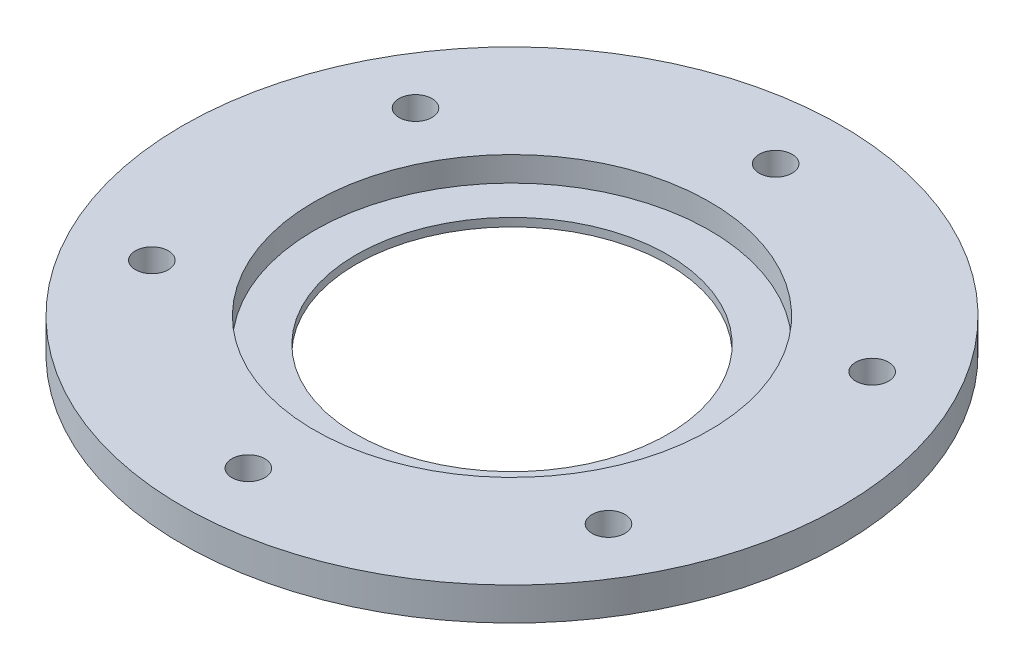
from build123d import *

# Parameters (mm, degrees)
CUT_EXTRUDE_1_REACH = 285.549
SKETCH_5_R          = 10


with BuildPart() as part:
    # 草圖4 → 旋轉1 (revolve)
    with BuildSketch(Plane.XY, mode=Mode.PRIVATE) as revolve_1_sk:
        Polygon((120, 20), (120, 5), (94.5, 5), (94.5, 0), (200, 0), (200, 20), align=None)
    revolve(revolve_1_sk.sketch.rotate(Axis((0, 45.980375907, 0), (0, -1, 0)), 180), axis=Axis((0, 45.980375907, 0), (0, -1, 0)))

    # 草圖5 → 除料-伸長1 (cut, up to next)
    with BuildSketch(Plane(origin=(0, 20, 0), x_dir=(1, 0, 0), z_dir=(0, 1, 0)), mode=Mode.PRIVATE) as cut_extrude_1_sk1:
        with Locations(Location((0, 160, 0), (0, 0, 180))):
            Circle(SKETCH_5_R)
    cut_extrude_1_tool1 = extrude(cut_extrude_1_sk1.sketch, amount=-CUT_EXTRUDE_1_REACH, mode=Mode.PRIVATE) & part.part
    # 草圖5 → 除料-伸長1 (cut, up to next)
    with BuildSketch(Plane(origin=(0, 20, 0), x_dir=(1, 0, 0), z_dir=(0, 1, 0)), mode=Mode.PRIVATE) as cut_extrude_1_sk2:
        with Locations(Location((138.564064606, 80, 0), (0, 0, 180))):
            Circle(SKETCH_5_R)
    cut_extrude_1_tool2 = extrude(cut_extrude_1_sk2.sketch, amount=-CUT_EXTRUDE_1_REACH, mode=Mode.PRIVATE) & part.part
    # 草圖5 → 除料-伸長1 (cut, up to next)
    with BuildSketch(Plane(origin=(0, 20, 0), x_dir=(1, 0, 0), z_dir=(0, 1, 0)), mode=Mode.PRIVATE) as cut_extrude_1_sk3:
        with Locations(Location((138.564064606, -80, 0), (0, 0, 180))):
            Circle(SKETCH_5_R)
    cut_extrude_1_tool3 = extrude(cut_extrude_1_sk3.sketch, amount=-CUT_EXTRUDE_1_REACH, mode=Mode.PRIVATE) & part.part
    # 草圖5 → 除料-伸長1 (cut, up to next)
    with BuildSketch(Plane(origin=(0, 20, 0), x_dir=(1, 0, 0), z_dir=(0, 1, 0)), mode=Mode.PRIVATE) as cut_extrude_1_sk4:
        with Locations(Location((0, -160, 0), (0, 0, 180))):
            Circle(SKETCH_5_R)
    cut_extrude_1_tool4 = extrude(cut_extrude_1_sk4.sketch, amount=-CUT_EXTRUDE_1_REACH, mode=Mode.PRIVATE) & part.part
    # 草圖5 → 除料-伸長1 (cut, up to next)
    with BuildSketch(Plane(origin=(0, 20, 0), x_dir=(1, 0, 0), z_dir=(0, 1, 0)), mode=Mode.PRIVATE) as cut_extrude_1_sk5:
        with Locations(Location((-138.564064605, -80, 0), (0, 0, 180))):
            Circle(SKETCH_5_R)
    cut_extrude_1_tool5 = extrude(cut_extrude_1_sk5.sketch, amount=-CUT_EXTRUDE_1_REACH, mode=Mode.PRIVATE) & part.part
    # 草圖5 → 除料-伸長1 (cut, up to next)
    with BuildSketch(Plane(origin=(0, 20, 0), x_dir=(1, 0, 0), z_dir=(0, 1, 0)), mode=Mode.PRIVATE) as cut_extrude_1_sk6:
        with Locations(Location((-138.564064606, 80, 0), (0, 0, 180))):
            Circle(SKETCH_5_R)
    cut_extrude_1_tool6 = extrude(cut_extrude_1_sk6.sketch, amount=-CUT_EXTRUDE_1_REACH, mode=Mode.PRIVATE) & part.part
    add(cut_extrude_1_tool1.solids().sort_by_distance((0, 20, -160))[0], mode=Mode.SUBTRACT)
    add(cut_extrude_1_tool2.solids().sort_by_distance((138.564065, 20, -80))[0], mode=Mode.SUBTRACT)
    add(cut_extrude_1_tool3.solids().sort_by_distance((138.564065, 20, 80))[0], mode=Mode.SUBTRACT)
    add(cut_extrude_1_tool4.solids().sort_by_distance((0, 20, 160))[0], mode=Mode.SUBTRACT)
    add(cut_extrude_1_tool5.solids().sort_by_distance((-138.564065, 20, 80))[0], mode=Mode.SUBTRACT)
    add(cut_extrude_1_tool6.solids().sort_by_distance((-138.564065, 20, -80))[0], mode=Mode.SUBTRACT)


solid = part.part
